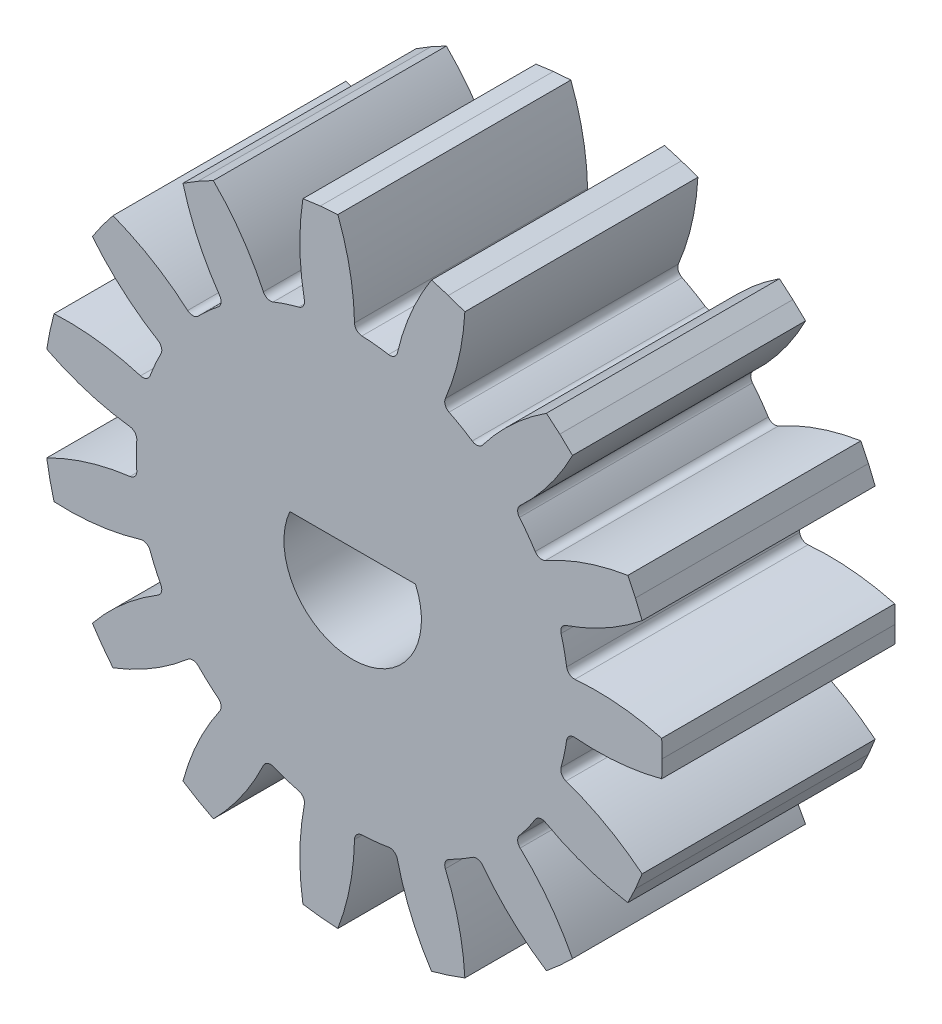
from build123d import *

# Parameters (mm, degrees)
BOSS_EXTRUDE1_DEPTH      = 10
FILLET1_R                = 0.3325
CIRPATTERN1_COUNT        = 15
FILLET1_OF_CIRPATTERN1_R = 0.3325
CUT_EXTRUDE1_REACH       = 23.269


with BuildPart() as part:
    # Sketch1 → Boss-Extrude1 (new body)
    with BuildSketch(Plane.XY):
        with BuildLine():
            Line((13.259889375, 0.752951085), (13.28125, 0))
            Line((13.28125, 0), (13.259889375, -0.752951085))
            ThreePointArc((13.259889375, -0.752951085), (11.25470075, -1.091188935), (9.221588785, -1.050667328))
            ThreePointArc((9.221588785, -1.050667328), (9.160560027, -1.491891937), (9.078432419, -1.92968038))
            Line((9.078432419, -1.92968038), (0, 0))
            Line((0, 0), (9.078432419, 1.92968038))
            ThreePointArc((9.078432419, 1.92968038), (9.160560027, 1.491891937), (9.221588785, 1.050667328))
            ThreePointArc((9.221588785, 1.050667328), (11.25470075, 1.091188935), (13.259889375, 0.752951085))
        make_face()
    boss_extrude1 = extrude(amount=BOSS_EXTRUDE1_DEPTH)

    # Fillet1
    fillet1_edges = [part.edges().sort_by_distance(p)[0] for p in [
        (9.221588785, 1.050667328, 5),
        (9.221588785, -1.050667328, 5),
    ]]
    fillet(fillet1_edges, radius=FILLET1_R)

    # CirPattern1: Boss-Extrude1 ×15 about axis
    cirpattern1_axis = Axis((0, 0, 0), (0, 0, 1))
    for i in range(1, CIRPATTERN1_COUNT):
        add(boss_extrude1.rotate(cirpattern1_axis, i * 360 / CIRPATTERN1_COUNT))

    # Fillet1 of CirPattern1
    fillet1_of_cirpattern1_edges = [part.edges().sort_by_distance(p)[0] for p in [
        (7.996995645, 4.710590431, 5),
        (8.851685449, 2.790925702, 5),
        (5.389649308, 7.556009655, 5),
        (6.951245284, 6.149942323, 5),
        (1.850383641, 9.094926165, 5),
        (3.848871658, 8.445578045, 5),
        (-2.008830167, 9.061247316, 5),
        (0.080993158, 9.280896598, 5),
        (-5.52069899, 7.460796488, 5),
        (-3.700889796, 8.511463815, 5),
        (-8.077988803, 4.570306167, 5),
        (-6.842855282, 6.270321614, 5),
        (-9.238520966, 0.889568391, 5),
        (-8.801628925, 2.944983842, 5),
        (-8.801628925, -2.944983842, 5),
        (-9.238520966, -0.889568391, 5),
        (-6.842855282, -6.270321614, 5),
        (-8.077988803, -4.570306167, 5),
        (-3.700889796, -8.511463815, 5),
        (-5.52069899, -7.460796488, 5),
        (0.080993158, -9.280896598, 5),
        (-2.008830167, -9.061247316, 5),
        (3.848871658, -8.445578045, 5),
        (1.850383641, -9.094926165, 5),
        (6.951245284, -6.149942323, 5),
        (5.389649308, -7.556009655, 5),
        (8.851685449, -2.790925702, 5),
        (7.996995645, -4.710590431, 5),
    ]]
    fillet(fillet1_of_cirpattern1_edges, radius=FILLET1_OF_CIRPATTERN1_R)

    # Sketch2 → Cut-Extrude1 (cut, up to next)
    with BuildSketch(Plane(origin=(0, 0, 0), x_dir=(-1, 0, 0), z_dir=(0, 0, -1)), mode=Mode.PRIVATE) as cut_extrude1_sk1:
        with BuildLine():
            Line((-2.694902596, 1.2), (2.694902596, 1.2))
            ThreePointArc((2.694902596, 1.2), (0, -2.95), (-2.694902596, 1.2))
        make_face()
    cut_extrude1_tool1 = extrude(cut_extrude1_sk1.sketch, amount=-CUT_EXTRUDE1_REACH, mode=Mode.PRIVATE) & part.part
    add(cut_extrude1_tool1.solids().sort_by_distance((0, -0.634948, 0))[0], mode=Mode.SUBTRACT)


solid = part.part
